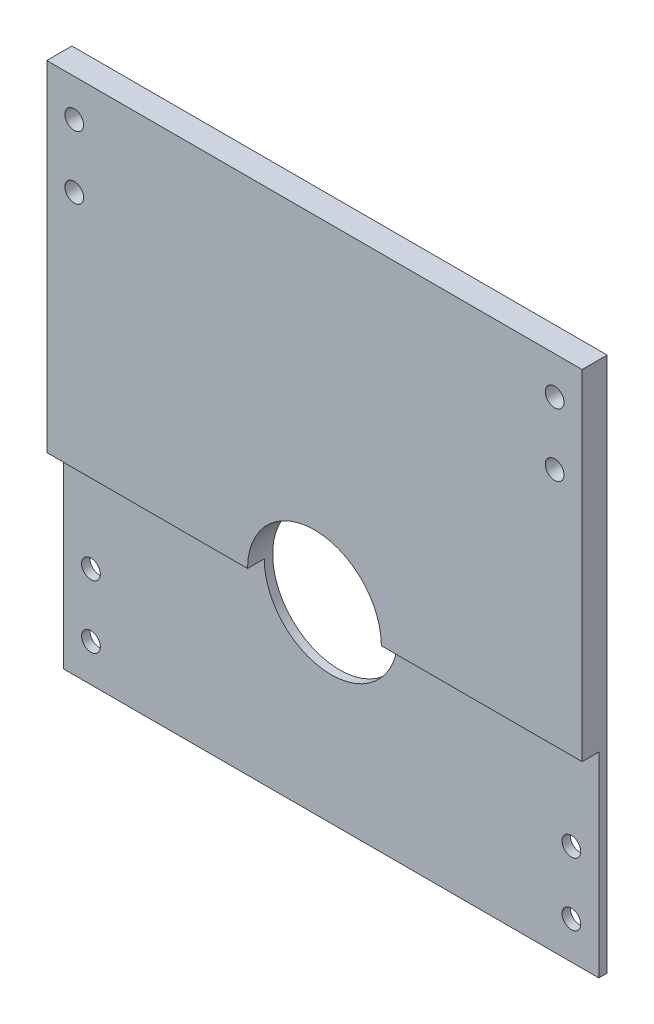
from build123d import *

# Parameters (mm, degrees)
SKETCH_1_W          = 406.4
SKETCH_1_H          = 406.4
SKETCH_1_R          = 50.8
EXTRUDE_1_DEPTH     = 19.05
CUT_EXTRUDE_START   = -12.7
CUT_EXTRUDE_1_DEPTH = 12.7
SKETCH_4_R          = 7.112
CUT_EXTRUDE_4_DEPTH = 288.998927949


with BuildPart() as part:
    # 草图1 → 凸台-拉伸1 (new body)
    with BuildSketch(Plane.XY):
        Rectangle(SKETCH_1_W, SKETCH_1_H)
        with Locations(Location((0, -54.602000016, 0), (0, 0, 180))):
            Circle(SKETCH_1_R, mode=Mode.SUBTRACT)
    extrude(amount=EXTRUDE_1_DEPTH)

    # 草图3 → 切除-拉伸1 (cut)
    with BuildSketch(Plane.XY.offset(19.05).offset(CUT_EXTRUDE_START)):
        with BuildLine():
            Line((-50.8, -54.602000016), (-203.2, -54.602000016))
            Line((-203.2, -54.602000016), (-203.2, -203.2))
            Line((-203.2, -203.2), (203.2, -203.2))
            Line((203.2, -203.2), (203.2, -54.602000016))
            Line((203.2, -54.602000016), (50.8, -54.602000016))
            ThreePointArc((50.8, -54.602000016), (0, -105.402000016), (-50.8, -54.602000016))
        make_face()
    extrude(amount=CUT_EXTRUDE_1_DEPTH, mode=Mode.SUBTRACT)

    # 草图4 → 切除-拉伸4 (cut, through all)
    with BuildSketch(Plane.XY):
        with Locations(Location((-182.372, 174.752, 0), (0, 0, 180))):
            Circle(SKETCH_4_R)
        with Locations(Location((-182.372, 127, 0), (0, 0, 180))):
            Circle(SKETCH_4_R)
        with Locations(Location((182.372, 127, 0), (0, 0, 180))):
            Circle(SKETCH_4_R)
        with Locations(Location((182.372, 174.752, 0), (0, 0, 180))):
            Circle(SKETCH_4_R)
        with Locations(Location((182.372, -174.752, 0), (0, 0, 180))):
            Circle(SKETCH_4_R)
        with Locations(Location((182.372, -127, 0), (0, 0, 180))):
            Circle(SKETCH_4_R)
        with Locations(Location((-182.372, -174.752, 0), (0, 0, 180))):
            Circle(SKETCH_4_R)
        with Locations(Location((-182.372, -127, 0), (0, 0, 180))):
            Circle(SKETCH_4_R)
    extrude(amount=CUT_EXTRUDE_4_DEPTH, mode=Mode.SUBTRACT)


solid = part.part
